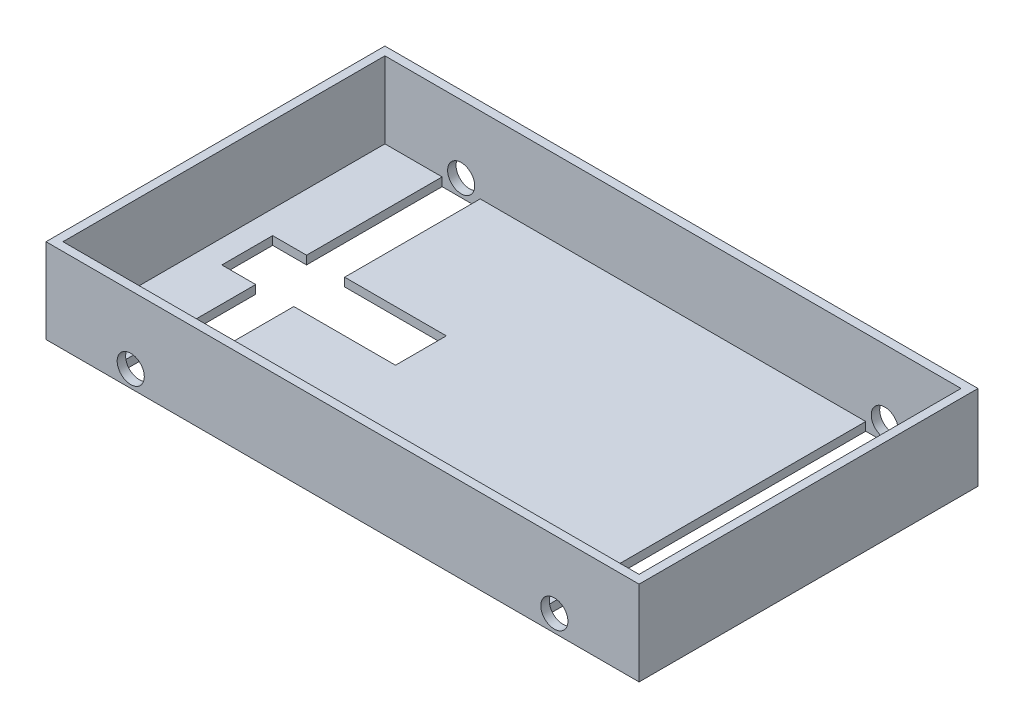
from build123d import *

# Parameters (mm, degrees)
SKETCH1_W           = 350
SKETCH1_H           = 200
BOSS_EXTRUDE1_DEPTH = 50
SHELL1_T            = -5
CUT_EXTRUDE1_REACH  = 272.416
SKETCH3_R           = 8
SKETCH4_W           = 17.489995996
SKETCH4_H           = 190
SKETCH4_W_2         = 5
CUT_EXTRUDE4_DEPTH  = 10
SKETCH5_W           = 102.489995996
SKETCH5_H           = 30
CUT_EXTRUDE5_DEPTH  = 10


with BuildPart() as part:
    # Sketch1 → Boss-Extrude1 (new body)
    with BuildSketch(Plane(origin=(0, 0, 0), x_dir=(1, 0, 0), z_dir=(0, 1, 0))):
        Rectangle(SKETCH1_W, SKETCH1_H)
    extrude(amount=BOSS_EXTRUDE1_DEPTH)

    # Shell1
    shell1_openings = [part.faces().sort_by_distance(p)[0] for p in [
        (0, 50, 0),
    ]]
    offset(amount=SHELL1_T, openings=shell1_openings, kind=Kind.INTERSECTION)

    # Cut-Extrude1: up to this face of the body (flat: up to its plane)
    cut_extrude1_end = Plane(part.part.faces().sort_by_distance((0, 25, -100))[0])
    # Sketch3 → Cut-Extrude1 (cut, up to the picked face)
    with BuildSketch(Plane.XY.offset(100), mode=Mode.PRIVATE) as cut_extrude1_sk1:
        with Locations((-125, 10)):
            Circle(SKETCH3_R)
    cut_extrude1_tool1 = split(extrude(cut_extrude1_sk1.sketch, amount=-CUT_EXTRUDE1_REACH, mode=Mode.PRIVATE), bisect_by=cut_extrude1_end, keep=Keep.BOTH, mode=Mode.PRIVATE)
    # Sketch3 → Cut-Extrude1 (cut, up to the picked face)
    with BuildSketch(Plane.XY.offset(100), mode=Mode.PRIVATE) as cut_extrude1_sk2:
        with Locations((125, 10)):
            Circle(SKETCH3_R)
    cut_extrude1_tool2 = split(extrude(cut_extrude1_sk2.sketch, amount=-CUT_EXTRUDE1_REACH, mode=Mode.PRIVATE), bisect_by=cut_extrude1_end, keep=Keep.BOTH, mode=Mode.PRIVATE)
    add(cut_extrude1_tool1.solids().sort_by(Axis((-125, 10, 100), (0, 0, -1)))[0], mode=Mode.SUBTRACT)
    add(cut_extrude1_tool2.solids().sort_by(Axis((125, 10, 100), (0, 0, -1)))[0], mode=Mode.SUBTRACT)

    # Sketch4 → Cut-Extrude4 (cut)
    with BuildSketch(Plane(origin=(0, 5, 0), x_dir=(1, 0, 0), z_dir=(0, 1, 0))):
        with Locations((-127.5, 0)):
            Rectangle(SKETCH4_W, SKETCH4_H)
        with Locations((-116.255002002, 0)):
            Rectangle(SKETCH4_W_2, SKETCH4_H)
        with Locations((116.255002002, 0)):
            Rectangle(SKETCH4_W_2, SKETCH4_H)
        with Locations((127.5, 0)):
            Rectangle(SKETCH4_W, SKETCH4_H)
    extrude(amount=-CUT_EXTRUDE4_DEPTH, mode=Mode.SUBTRACT)

    # Sketch5 → Cut-Extrude5 (cut)
    with BuildSketch(Plane(origin=(0, 5, 0), x_dir=(1, 0, 0), z_dir=(0, 1, 0))):
        with Locations((-105, 0)):
            Rectangle(SKETCH5_W, SKETCH5_H)
    extrude(amount=-CUT_EXTRUDE5_DEPTH, mode=Mode.SUBTRACT)


solid = part.part
